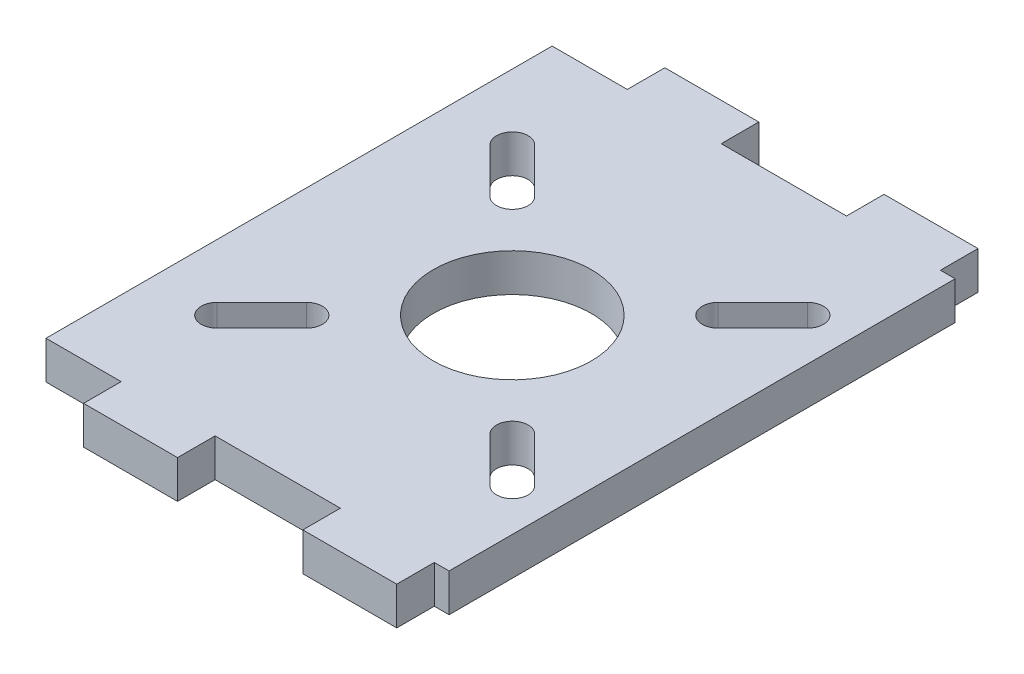
from build123d import *

# Parameters (mm, degrees)
SKETCH1_R           = 12.5
BOSS_EXTRUDE1_DEPTH = 6


with BuildPart() as part:
    # Sketch1 → Boss-Extrude1 (new body)
    with BuildSketch(Plane(origin=(0, 0, 0), x_dir=(1, 0, 0), z_dir=(0, 1, 0))):
        Polygon((-33.710320086, 36.107507173), (-33.710320086, -43.892492827), (-21.830156213, -43.892492827), (-21.830156213, -49.832574764), (-6.979951371, -49.832574764), (-6.979951371, -43.892492827), (12.820321751, -43.892492827), (12.820321751, -49.832574764), (27.670526593, -49.832574764), (27.670526593, -43.892492827), (30.000473961, -43.892492827), (30.000473961, 36.107507173), (27.670526593, 36.107507173), (27.670526593, 42.047589109), (12.820321751, 42.047589109), (12.820321751, 36.107507173), (-6.979951371, 36.107507173), (-6.979951371, 42.047589109), (-21.830156213, 42.047589109), (-21.830156213, 36.107507173), align=None)
        with Locations(Location((0, -3.892492827, 0), (0, 0, 270))):
            Circle(SKETCH1_R, mode=Mode.SUBTRACT)
        with BuildLine():
            Line((-25.103576844, -25.460535765), (-18.032509032, -18.389467953))
            ThreePointArc((-18.032509032, -18.389467953), (-14.496975126, -18.389467953), (-14.496975126, -21.925001859))
            Line((-14.496975126, -21.925001859), (-21.568042938, -28.996069671))
            ThreePointArc((-21.568042938, -28.996069671), (-25.103576844, -28.996069671), (-25.103576844, -25.460535765))
        make_face(mode=Mode.SUBTRACT)
        with BuildLine():
            Line((-21.568042938, 21.211084017), (-14.496975126, 14.140016205))
            ThreePointArc((-14.496975126, 14.140016205), (-14.496975126, 10.604482299), (-18.032509032, 10.604482299))
            Line((-18.032509032, 10.604482299), (-25.103576844, 17.675550111))
            ThreePointArc((-25.103576844, 17.675550111), (-25.103576844, 21.211084017), (-21.568042938, 21.211084017))
        make_face(mode=Mode.SUBTRACT)
        with BuildLine():
            Line((25.103576844, 17.675550111), (18.032509032, 10.604482299))
            ThreePointArc((18.032509032, 10.604482299), (14.496975126, 10.604482299), (14.496975126, 14.140016205))
            Line((14.496975126, 14.140016205), (21.568042938, 21.211084017))
            ThreePointArc((21.568042938, 21.211084017), (25.103576844, 21.211084017), (25.103576844, 17.675550111))
        make_face(mode=Mode.SUBTRACT)
        with BuildLine():
            Line((21.568042938, -28.996069671), (14.496975126, -21.925001859))
            ThreePointArc((14.496975126, -21.925001859), (14.496975126, -18.389467953), (18.032509032, -18.389467953))
            Line((18.032509032, -18.389467953), (25.103576844, -25.460535765))
            ThreePointArc((25.103576844, -25.460535765), (25.103576844, -28.996069671), (21.568042938, -28.996069671))
        make_face(mode=Mode.SUBTRACT)
    extrude(amount=BOSS_EXTRUDE1_DEPTH)


solid = part.part
